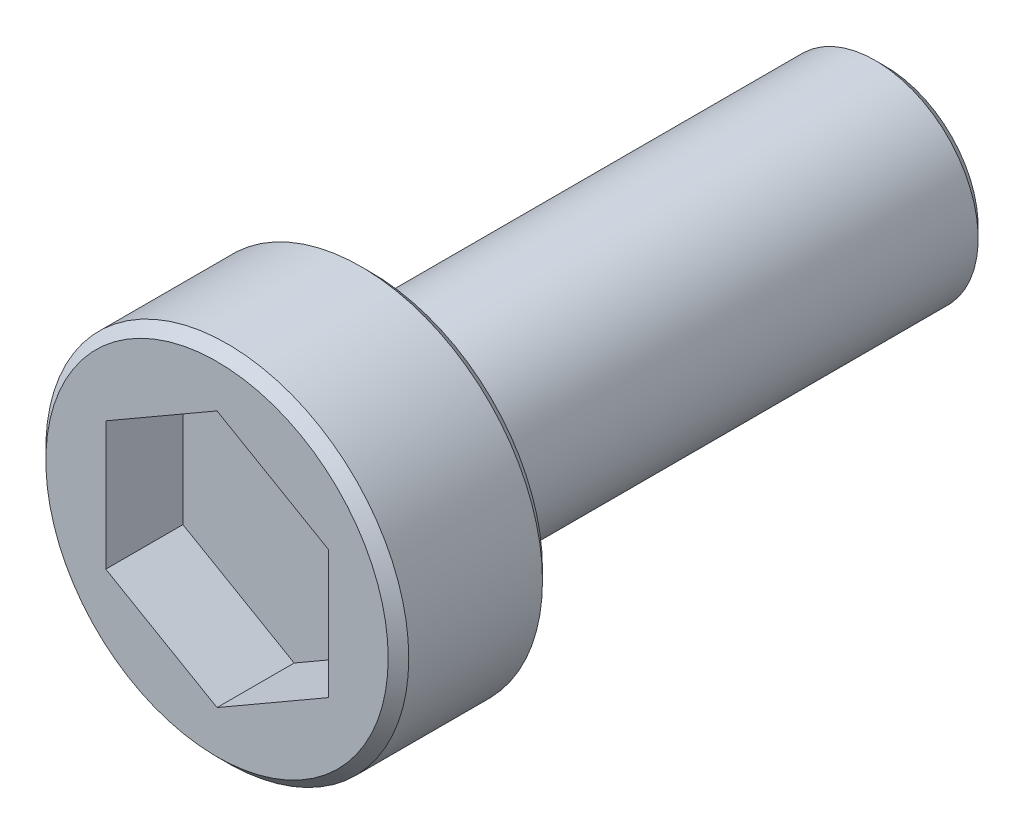
from build123d import *

# Parameters (mm, degrees)
SKETCH_1_R          = 2
EXTRUDE_1_DEPTH     = 16
SKETCH_2_R          = 3.52854217
EXTRUDE_3_DEPTH     = 3
CUT_EXTRUDE_2_DEPTH = 1.5
CHAMFER_1_SIZE      = 0.2
CHAMFER_2_SIZE      = 0.2
SKETCH_4_R          = 2
CUT_EXTRUDE_3_DEPTH = 6
CHAMFER_3_SIZE      = 0.2


with BuildPart() as part:
    # 草图1 → 凸台-拉伸1 (new body)
    with BuildSketch(Plane.XY):
        Circle(SKETCH_1_R)
    extrude(amount=EXTRUDE_1_DEPTH)

    # 草图2 → 凸台-拉伸3 (add)
    with BuildSketch(Plane.XY.offset(16)):
        Circle(SKETCH_2_R)
    extrude(amount=EXTRUDE_3_DEPTH)

    # 草图3 → 切除-拉伸2 (cut)
    with BuildSketch(Plane.XY.offset(19)):
        Polygon((0, 2.497687594), (-2.163060907, 1.248843797), (-2.163060907, -1.248843797), (0, -2.497687594), (2.163060907, -1.248843797), (2.163060907, 1.248843797), align=None)
    extrude(amount=-CUT_EXTRUDE_2_DEPTH, mode=Mode.SUBTRACT)

    # 倒角1
    chamfer_1_edges = [part.edges().sort_by_distance(p)[0] for p in [
        (-2, 0, 0),
    ]]
    chamfer(chamfer_1_edges, length=CHAMFER_1_SIZE)

    # 倒角2
    chamfer_2_edges = [part.edges().sort_by_distance(p)[0] for p in [
        (-3.52854217, 0, 16),
        (-3.52854217, 0, 19),
    ]]
    chamfer(chamfer_2_edges, length=CHAMFER_2_SIZE)

    # 草图4 → 切除-拉伸3 (cut)
    with BuildSketch(Plane(origin=(0, 0, 0), x_dir=(-1, 0, 0), z_dir=(0, 0, -1))):
        Circle(SKETCH_4_R)
    extrude(amount=-CUT_EXTRUDE_3_DEPTH, mode=Mode.SUBTRACT)

    # 倒角3
    chamfer_3_edges = [part.edges().sort_by_distance(p)[0] for p in [
        (-2, 0, 6),
    ]]
    chamfer(chamfer_3_edges, length=CHAMFER_3_SIZE)


solid = part.part
